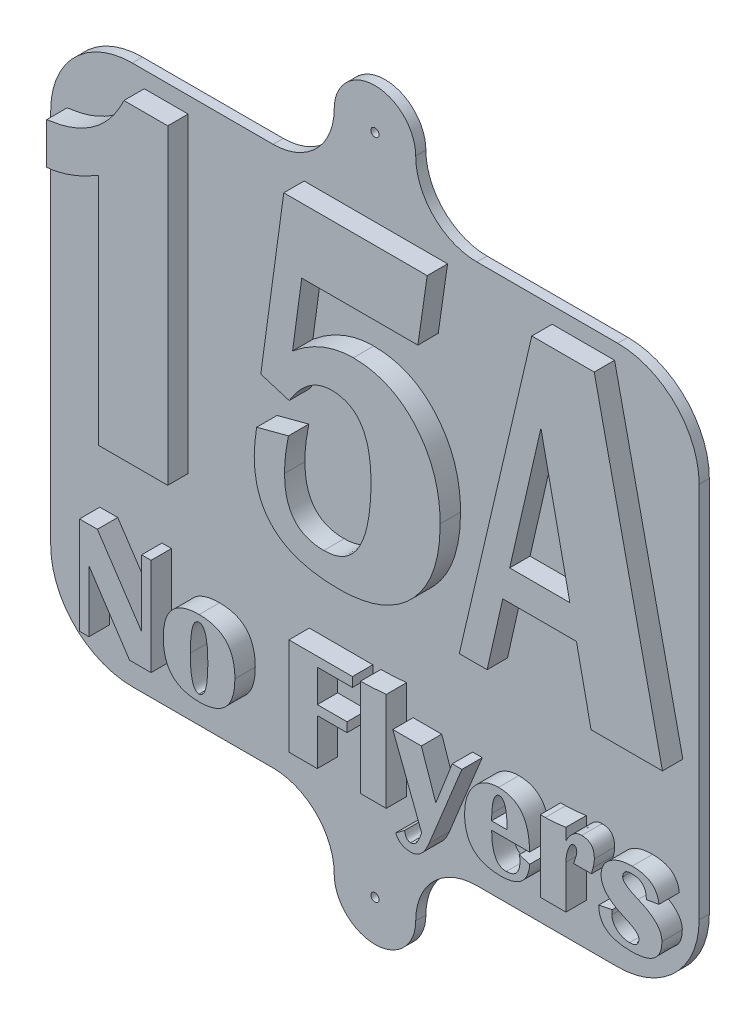
from build123d import *

# Parameters (mm, degrees)
BOSS_EXTRUDE3_DEPTH = 2.5
SKETCH3_W           = 79.552881877
SKETCH3_H           = 66.272296509
SKETCH3_R           = 0.5
BOSS_EXTRUDE4_DEPTH = 1.25
FILLET1_R           = 10


with BuildPart() as part:
    # Sketch2 → Boss-Extrude3 (new body)
    # profile 1 of 12: a face of its own
    with BuildSketch(Plane.XY):
        with BuildLine():
            add(Edge.make_bspline(
                [(-39.505642361, 34.550055371), (-38.445127374, 34.688560168), (-36.891314498, 35.018793509), (-35.009315958, 35.870899211), (-33.74203724, 36.630490301), (-32.614537052, 37.573280944), (-31.253370012, 39.06085279), (-30.463976145, 40.383787992), (-30.030445523, 41.322790119)],
                knots=[0, 0, 0, 0, 0.263348654, 0.386091944, 0.506109964, 0.625172173, 0.745756987, 1, 1, 1, 1], degree=3))
            Line((-30.030445523, 41.322790119), (-24.650390625, 41.322790119))
            Line((-24.650390625, 41.322790119), (-24.650390625, 3.123571362))
            Line((-24.650390625, 3.123571362), (-33.139105903, 3.123571362))
            Line((-33.139105903, 3.123571362), (-33.139105903, 31.814434237))
            add(Edge.make_bspline(
                [(-33.139105903, 31.814434237), (-34.190562264, 31.180201515), (-36.234098653, 30.145269288), (-38.455956486, 29.571261215), (-39.505642361, 29.485011392)],
                knots=[0, 0, 0, 0, 0.539331809, 1, 1, 1, 1], degree=3))
            Line((-39.505642361, 29.485011392), (-39.505642361, 34.550055371))
        make_face()
    # profile 2 of 12: a face of its own
    with BuildSketch(Plane.XY):
        with BuildLine():
            add(Edge.make_bspline(
                [(-4.580879211, 23.284270154), (-5.059567577, 23.28608701), (-5.782990797, 23.162477543), (-6.688456619, 22.774548571), (-7.349639699, 22.359116401), (-7.987212902, 21.832786439), (-8.850183119, 20.942489776), (-9.400196179, 20.145903569), (-9.753690084, 19.578746981)],
                knots=[0, 0, 0, 0, 0.215337028, 0.326396667, 0.442196288, 0.566125513, 0.6982596, 1, 1, 1, 1], degree=3))
            Line((-9.753690084, 19.578746981), (-13.235389709, 20.648126152))
            Line((-13.235389709, 20.648126152), (-10.416870965, 41.322790119))
            Line((-10.416870965, 41.322790119), (7.182291667, 41.322790119))
            Line((7.182291667, 41.322790119), (6.038304647, 33.364619546))
            Line((6.038304647, 33.364619546), (-8.211794535, 33.364619546))
            Line((-8.211794535, 33.364619546), (-9.339202033, 25.04998925))
            add(Edge.make_bspline(
                [(-9.339202033, 25.04998925), (-8.763173237, 25.526707746), (-7.878700057, 26.187072836), (-6.619881278, 26.889360816), (-5.68877436, 27.314716256), (-4.752312016, 27.649447295), (-3.492933144, 27.96063282), (-2.529162707, 28.056524037), (-1.886706882, 28.059172498)],
                knots=[0, 0, 0, 0, 0.273617619, 0.402082648, 0.526428614, 0.647547073, 0.765176175, 1, 1, 1, 1], degree=3))
            add(Edge.make_bspline(
                [(-1.886706882, 28.059172498), (-1.140841476, 28.048091191), (-0.030086294, 27.967005084), (1.37906108, 27.587424966), (2.375599175, 27.217388054), (3.314915233, 26.724394261), (4.199589184, 26.120890577), (5.03257365, 25.414171651), (5.797467794, 24.599408527), (6.500213345, 23.713190518), (7.109953259, 22.751053852), (7.620549298, 21.729899756), (8.052705652, 20.651107006), (8.368136201, 19.506929688), (8.687339903, 17.872330425), (8.769942937, 16.602413182), (8.773925781, 15.740587632)],
                knots=[0, 0, 0, 0, 0.122904352, 0.181634751, 0.23943005, 0.297339499, 0.355551071, 0.415172498, 0.476547268, 0.538982141, 0.60086089, 0.663434435, 0.726450003, 0.791595906, 0.858237271, 1, 1, 1, 1], degree=3))
            add(Edge.make_bspline(
                [(8.773925781, 15.740587632), (8.775493249, 14.784624301), (8.686794731, 13.376416231), (8.323182949, 11.576863806), (7.964081074, 10.328779394), (7.47409475, 9.168978643), (6.908996179, 8.070160772), (6.210531329, 7.065769782), (5.425080361, 6.135419684), (4.549004599, 5.298849359), (3.59048864, 4.570749654), (2.552728311, 3.968214616), (1.452712079, 3.452512816), (0.271579796, 3.067017359), (-1.438724347, 2.694397349), (-2.775838902, 2.596705671), (-3.685585022, 2.593026664)],
                knots=[0, 0, 0, 0, 0.140185445, 0.205864866, 0.268779519, 0.330146384, 0.390104813, 0.449524749, 0.508998478, 0.568289941, 0.626685414, 0.684955785, 0.74384205, 0.8044141, 0.866610454, 1, 1, 1, 1], degree=3))
            add(Edge.make_bspline(
                [(-3.685585022, 2.593026664), (-4.497357112, 2.587700427), (-5.675488444, 2.655371795), (-7.184831995, 2.887695521), (-8.196212841, 3.14267276), (-9.139359184, 3.436448016), (-9.990224348, 3.835437645), (-10.765554763, 4.288700123), (-11.462031127, 4.813802932), (-12.070534507, 5.4147509), (-12.595352473, 6.085605068), (-13.051673671, 6.821487136), (-13.409886945, 7.635556627), (-13.696403784, 8.515454112), (-13.961664415, 9.819802377), (-14.043575294, 10.843550354), (-14.039496528, 11.545968559)],
                knots=[0, 0, 0, 0, 0.155259741, 0.225407628, 0.291834243, 0.354701943, 0.414082297, 0.471209562, 0.526304094, 0.58051628, 0.634355904, 0.68894579, 0.745744241, 0.804098836, 0.865695261, 1, 1, 1, 1], degree=3))
            add(Edge.make_bspline(
                [(-14.039496528, 11.545968559), (-14.044192412, 12.030840125), (-13.967980077, 13.103855981), (-13.839429401, 14.171429561), (-13.741065131, 14.754106071)],
                knots=[0, 0, 0, 0, 0.450571848, 1, 1, 1, 1], degree=3))
            Line((-13.741065131, 14.754106071), (-9.844877455, 15.782036437))
            add(Edge.make_bspline(
                [(-9.844877455, 15.782036437), (-9.994612039, 15.046961321), (-10.226082233, 13.641057517), (-10.323306762, 12.219271686), (-10.325683594, 11.545968559)],
                knots=[0, 0, 0, 0, 0.527122793, 1, 1, 1, 1], degree=3))
            add(Edge.make_bspline(
                [(-10.325683594, 11.545968559), (-10.320110705, 10.702120337), (-10.229105589, 9.483504972), (-9.693211239, 8.043206132), (-9.155465437, 7.207702537), (-8.463278813, 6.549344714), (-7.264623028, 5.919277756), (-6.216531663, 5.774953975), (-5.501042684, 5.776294893)],
                knots=[0, 0, 0, 0, 0.295855371, 0.419781312, 0.532649116, 0.639755306, 0.749346034, 1, 1, 1, 1], degree=3))
            add(Edge.make_bspline(
                [(-5.501042684, 5.776294893), (-5.045254774, 5.781649336), (-4.371246406, 5.842162801), (-3.532560249, 6.117613131), (-2.962656256, 6.402271857), (-2.438993914, 6.769600946), (-1.959263911, 7.216094035), (-1.530841464, 7.743862513), (-1.134272633, 8.341668537), (-0.810012691, 9.033832726), (-0.507370742, 9.795326572), (-0.263149171, 10.642764361), (-0.065985036, 11.568556584), (0.088733138, 12.570659222), (0.251205259, 14.064313026), (0.278576995, 15.229128276), (0.285210503, 16.030729267)],
                knots=[0, 0, 0, 0, 0.103750029, 0.151958221, 0.199653436, 0.247861628, 0.296690369, 0.347937724, 0.401879003, 0.459116012, 0.521093761, 0.587793935, 0.659039074, 0.735878741, 0.817905989, 1, 1, 1, 1], degree=3))
            add(Edge.make_bspline(
                [(0.285210503, 16.030729267), (0.286619968, 16.597679808), (0.259018271, 17.422515281), (0.119691439, 18.479375082), (-0.010863514, 19.188118882), (-0.171771274, 19.845741927), (-0.393396701, 20.436775307), (-0.62555673, 20.986451231), (-0.923479598, 21.466375106), (-1.240444341, 21.901010341), (-1.606175863, 22.270956396), (-2.001928899, 22.591610221), (-2.451192391, 22.838971661), (-2.928992048, 23.038397625), (-3.637146716, 23.231850306), (-4.196212354, 23.293434873), (-4.580879211, 23.284270154)],
                knots=[0, 0, 0, 0, 0.171740255, 0.249366064, 0.322554505, 0.389926052, 0.453973794, 0.513524595, 0.570202533, 0.624586185, 0.67606019, 0.727281986, 0.778236591, 0.830753979, 0.883735839, 1, 1, 1, 1], degree=3))
        make_face()
    # profile 3 of 12: a face of its own
    with BuildSketch(Plane.XY):
        Polygon((20.014841715, 41.322790112), (27.674580892, 41.322790112), (36.047239516, 3.123571362), (27.284962124, 3.123571362), (25.494373745, 11.61228664), (16.45024448, 11.61228664), (14.535309686, 3.123571362), (11.119928148, 3.123571362), align=None)
        Polygon((21.133959452, 32.08799635), (17.304089864, 15.326099581), (24.681977166, 15.326099581), align=None, mode=Mode.SUBTRACT)
    # profile 4 of 12: a face of its own
    with BuildSketch(Plane.XY):
        Polygon((-27.853597005, -5.862141344), (-26.693030463, -5.862141344), (-26.693030463, -17.799397203), (-29.337982337, -17.799397203), (-34.319610596, -10.268667432), (-34.319610596, -17.799397203), (-35.480177138, -17.799397203), (-35.480177138, -5.862141344), (-33.28857157, -5.862141344), (-27.853597005, -14.032737042), align=None)
    # profile 5 of 12: a face of its own
    with BuildSketch(Plane.XY):
        with BuildLine():
            add(Edge.make_bspline(
                [(-25.200873481, -13.322926258), (-25.199808417, -12.959454358), (-25.170610217, -12.429366062), (-25.053861248, -11.753153678), (-24.936176467, -11.297121985), (-24.780327029, -10.877988715), (-24.59096547, -10.494601291), (-24.36763662, -10.14623384), (-24.106488807, -9.837252475), (-23.814163268, -9.561349058), (-23.484616436, -9.324272765), (-23.120168704, -9.125470124), (-22.722569715, -8.960824497), (-22.290683429, -8.835058779), (-21.649984916, -8.711225384), (-21.146730704, -8.680740914), (-20.802119043, -8.68066009)],
                knots=[0, 0, 0, 0, 0.148709658, 0.216464644, 0.280365154, 0.341042124, 0.399003812, 0.454936463, 0.509829317, 0.564045499, 0.618933808, 0.675359287, 0.733466031, 0.794589432, 0.859000225, 1, 1, 1, 1], degree=3))
            add(Edge.make_bspline(
                [(-20.802119043, -8.68066009), (-20.458326838, -8.680710705), (-19.956072807, -8.711637248), (-19.316855525, -8.83457038), (-18.886202032, -8.961471103), (-18.489739702, -9.124733528), (-18.126813559, -9.324922356), (-17.797890875, -9.562242945), (-17.502775238, -9.835485717), (-17.244691179, -10.147264352), (-17.02104323, -10.494509991), (-16.831133298, -10.87748126), (-16.678957565, -11.297681956), (-16.561476378, -11.753376473), (-16.438004565, -12.428650985), (-16.418797238, -12.96000657), (-16.413726807, -13.322926258)],
                knots=[0, 0, 0, 0, 0.140796589, 0.205275965, 0.266125469, 0.324294085, 0.380470138, 0.435416891, 0.489949248, 0.544673781, 0.600665988, 0.658689393, 0.719308422, 0.783276971, 0.851165802, 1, 1, 1, 1], degree=3))
            add(Edge.make_bspline(
                [(-16.413726807, -13.322926258), (-16.418797238, -13.685845946), (-16.438004565, -14.21720153), (-16.561476378, -14.892476042), (-16.678957565, -15.348170559), (-16.831133298, -15.768371255), (-17.02104323, -16.151342524), (-17.244691179, -16.498588164), (-17.502775238, -16.810366799), (-17.797890875, -17.083609571), (-18.126813559, -17.320930159), (-18.489739702, -17.521118987), (-18.886202032, -17.684381413), (-19.316855525, -17.811282136), (-19.956072807, -17.934215268), (-20.458326838, -17.965141811), (-20.802119043, -17.965192425)],
                knots=[0, 0, 0, 0, 0.148834198, 0.216723029, 0.280691578, 0.341310607, 0.399334012, 0.455326219, 0.510050752, 0.564583109, 0.619529862, 0.675705915, 0.733874531, 0.794724035, 0.859203411, 1, 1, 1, 1], degree=3))
            add(Edge.make_bspline(
                [(-20.802119043, -17.965192425), (-21.146730704, -17.965111601), (-21.649984916, -17.934627132), (-22.290683429, -17.810793737), (-22.722569715, -17.685028018), (-23.120168704, -17.520382392), (-23.484616436, -17.321579751), (-23.814163268, -17.084503458), (-24.106488807, -16.808600041), (-24.36763662, -16.499618675), (-24.59096547, -16.151251225), (-24.780327029, -15.7678638), (-24.936176467, -15.348730531), (-25.053861248, -14.892698838), (-25.170610217, -14.216486453), (-25.199808417, -13.686398158), (-25.200873481, -13.322926258)],
                knots=[0, 0, 0, 0, 0.140999775, 0.205410568, 0.266533969, 0.324640713, 0.381066192, 0.435954501, 0.490170683, 0.545063537, 0.600996188, 0.658957876, 0.719634846, 0.783535356, 0.851290342, 1, 1, 1, 1], degree=3))
        make_face()
        with BuildLine():
            add(Edge.make_bspline(
                [(-19.729631212, -13.322926258), (-19.730675228, -13.024962949), (-19.737838705, -12.592878169), (-19.76659198, -12.036877652), (-19.793499023, -11.664318995), (-19.83305778, -11.321461181), (-19.878546296, -11.00845158), (-19.933199784, -10.72501291), (-19.99315475, -10.470654785), (-20.066759975, -10.247030901), (-20.144410449, -10.050967549), (-20.236730775, -9.887548812), (-20.330623634, -9.748866754), (-20.438911892, -9.64370472), (-20.590800232, -9.540019439), (-20.72514179, -9.510022654), (-20.812481244, -9.509636192)],
                knots=[0, 0, 0, 0, 0.211632714, 0.306816891, 0.3953858, 0.476859122, 0.551882003, 0.619958308, 0.68183531, 0.737301971, 0.787071811, 0.83127019, 0.870409447, 0.905537857, 0.937855771, 1, 1, 1, 1], degree=3))
            add(Edge.make_bspline(
                [(-20.812481244, -9.509636192), (-20.899100261, -9.510273737), (-21.031990949, -9.540795701), (-21.18342877, -9.64288498), (-21.288848216, -9.749970757), (-21.383667612, -9.886674278), (-21.471844408, -10.051924451), (-21.55155504, -10.246337228), (-21.61971072, -10.471670964), (-21.685321549, -10.724440377), (-21.738049309, -11.008584614), (-21.78503807, -11.321243135), (-21.820280674, -11.664524716), (-21.847303173, -12.036939298), (-21.882824225, -12.59266235), (-21.879840725, -13.025124816), (-21.884969076, -13.322926258)],
                knots=[0, 0, 0, 0, 0.061623225, 0.093987349, 0.128729036, 0.167924257, 0.211890854, 0.261731858, 0.317090777, 0.379205207, 0.447378852, 0.522509005, 0.604031764, 0.692727315, 0.788081222, 1, 1, 1, 1], degree=3))
            add(Edge.make_bspline(
                [(-21.884969076, -13.322926258), (-21.879840725, -13.6207277), (-21.882824225, -14.053190166), (-21.847303173, -14.608913218), (-21.820280674, -14.981327799), (-21.78503807, -15.32460938), (-21.738049309, -15.637267901), (-21.685321549, -15.921412139), (-21.61971072, -16.174181552), (-21.55155504, -16.399515288), (-21.471844408, -16.593928064), (-21.383667612, -16.759178237), (-21.288848216, -16.895881758), (-21.18342877, -17.002967536), (-21.031990949, -17.105056815), (-20.899100261, -17.135578778), (-20.812481244, -17.136216324)],
                knots=[0, 0, 0, 0, 0.211918778, 0.307272685, 0.395968236, 0.477490995, 0.552621148, 0.620794793, 0.682909223, 0.738268142, 0.788109146, 0.832075743, 0.871270964, 0.906012651, 0.938376775, 1, 1, 1, 1], degree=3))
            add(Edge.make_bspline(
                [(-20.812481244, -17.136216324), (-20.72514179, -17.135829861), (-20.590800232, -17.105833076), (-20.438911892, -17.002147796), (-20.330623634, -16.896985762), (-20.236730775, -16.758303703), (-20.144410449, -16.594884966), (-20.066759975, -16.398821615), (-19.99315475, -16.17519773), (-19.933199784, -15.920839606), (-19.878546296, -15.637400936), (-19.83305778, -15.324391335), (-19.793499023, -14.981533521), (-19.76659198, -14.608974863), (-19.737838705, -14.052974347), (-19.730675228, -13.620889567), (-19.729631212, -13.322926258)],
                knots=[0, 0, 0, 0, 0.062144229, 0.094462143, 0.129590553, 0.16872981, 0.212928189, 0.262698029, 0.31816469, 0.380041692, 0.448117997, 0.523140878, 0.6046142, 0.693183109, 0.788367286, 1, 1, 1, 1], degree=3))
        make_face(mode=Mode.SUBTRACT)
    # profile 6 of 12: a face of its own
    with BuildSketch(Plane.XY):
        Polygon((-9.781917996, -5.862141344), (-1.989542643, -5.862141344), (-1.989542643, -7.022707885), (-6.30021837, -7.022707885), (-6.30021837, -11.001793172), (-2.652723524, -11.001793172), (-2.652723524, -12.162359714), (-6.30021837, -12.162359714), (-6.30021837, -17.799397203), (-9.781917996, -17.799397203), align=None)
    # profile 7 of 12: a face of its own
    with BuildSketch(Plane.XY):
        with BuildLine():
            add(Edge.make_bspline(
                [(-0.994771322, -5.862141346), (-0.514268133, -5.86334203), (0.537261582, -5.823421243), (1.586205255, -5.74139959), (2.155337863, -5.688574474)],
                knots=[0, 0, 0, 0, 0.456659504, 1, 1, 1, 1], degree=3))
            Line((2.155337863, -5.688574474), (2.155337863, -17.799397203))
            Line((2.155337863, -17.799397203), (-0.994771322, -17.799397203))
            Line((-0.994771322, -17.799397203), (-0.994771322, -5.862141346))
        make_face()
    # profile 8 of 12: a face of its own
    with BuildSketch(Plane.XY):
        Polygon((7.855578814, -17.799397203), (11.43987018, -9.012250516), (10.2585793, -9.012250526), (8.237950026, -14.180398397), (6.463423086, -9.012250506), (2.958408508, -9.012250506), (6.339029341, -17.799397203), align=None)
    # profile 9 of 12: a face of its own
    with BuildSketch(Plane.XY):
        with BuildLine():
            Line((7.401202255, -18.913333841), (7.855578814, -17.799397203))
            Line((7.855578814, -17.799397203), (6.339029341, -17.799397203))
            Line((6.339029341, -17.799397203), (6.507462396, -18.237200209))
            Line((6.507462396, -18.237200209), (6.271722317, -18.840798432))
            add(Edge.make_bspline(
                [(5.15260458, -19.954735068), (5.265802059, -19.954827595), (5.436099503, -19.916788761), (5.642671433, -19.801609873), (5.786170647, -19.674526737), (5.923083898, -19.51607111), (6.100314602, -19.242697678), (6.207626114, -19.008724332), (6.271722317, -18.840798432)],
                knots=[0, 0, 0, 0, 0.20135575, 0.305644868, 0.419428644, 0.541915361, 0.678833604, 1, 1, 1, 1], degree=3))
            add(Edge.make_bspline(
                [(4.409116639, -19.022136954), (4.43122098, -19.159352125), (4.469553453, -19.355261631), (4.568248762, -19.586153396), (4.653001256, -19.721195411), (4.756553301, -19.82572132), (4.917252549, -19.925910159), (5.058377186, -19.955038686), (5.15260458, -19.954735068)],
                knots=[0, 0, 0, 0, 0.318403671, 0.451751149, 0.571534756, 0.680293407, 0.784803943, 1, 1, 1, 1], degree=3))
            Line((4.409116639, -19.022136954), (3.308132754, -19.822617002))
            add(Edge.make_bspline(
                [(5.162966781, -20.94950639), (4.952584345, -20.94823218), (4.644503742, -20.920079381), (4.262877942, -20.800994057), (4.015508119, -20.672788572), (3.791945533, -20.515852717), (3.532597663, -20.244395672), (3.384717474, -19.999703564), (3.308132754, -19.822617002)],
                knots=[0, 0, 0, 0, 0.273060386, 0.397685986, 0.515848346, 0.632977305, 0.750149058, 1, 1, 1, 1], degree=3))
            add(Edge.make_bspline(
                [(7.401202255, -18.913333841), (7.271430513, -19.219251362), (7.068507035, -19.655198063), (6.711621668, -20.149181966), (6.440803878, -20.441013446), (6.148135151, -20.666381275), (5.736039843, -20.887437348), (5.390714718, -20.950582518), (5.162966781, -20.94950639)],
                knots=[0, 0, 0, 0, 0.310559017, 0.444830134, 0.566673871, 0.68033092, 0.787619396, 1, 1, 1, 1], degree=3))
        make_face()
    # profile 10 of 12: a face of its own
    with BuildSketch(Plane.XY):
        with BuildLine():
            add(Edge.make_bspline(
                [(18.56906467, -15.167398083), (18.564853802, -14.857239024), (18.470623758, -14.561209309)],
                knots=[0, 0, 0, 1, 1, 1], degree=2))
            Line((18.470623758, -14.561209309), (19.755536715, -14.936839105))
            add(Edge.make_bspline(
                [(19.755536715, -14.936839105), (19.740772735, -15.175284096), (19.696404618, -15.52338937), (19.574966039, -15.961960607), (19.464308676, -16.259500724), (19.326574833, -16.533459547), (19.162331676, -16.783115745), (18.974820137, -17.010855073), (18.761760322, -17.213662183), (18.522358537, -17.390811432), (18.260443601, -17.547687725), (17.970831946, -17.675862102), (17.657949274, -17.782732944), (17.319710157, -17.864720589), (16.821248846, -17.946768217), (16.431243939, -17.961698085), (16.165033976, -17.965192425)],
                knots=[0, 0, 0, 0, 0.135123648, 0.19740768, 0.256874256, 0.314280181, 0.370323378, 0.425440815, 0.480676976, 0.536121906, 0.593459322, 0.652877808, 0.714770498, 0.780113684, 0.849359563, 1, 1, 1, 1], degree=3))
            add(Edge.make_bspline(
                [(16.165033976, -17.965192425), (15.821386549, -17.964112716), (15.319537562, -17.934814873), (14.679729857, -17.817918545), (14.247540983, -17.700718952), (13.851206979, -17.543908593), (13.487495582, -17.35508031), (13.159409471, -17.127860407), (12.864173577, -16.868097449), (12.605965295, -16.572048594), (12.381934859, -16.243172317), (12.191991641, -15.879745034), (12.036046546, -15.481223945), (11.919059916, -15.047352154), (11.801324715, -14.40508605), (11.772806716, -13.901404484), (11.771460639, -13.556075786)],
                knots=[0, 0, 0, 0, 0.14444976, 0.210484388, 0.272977827, 0.332263421, 0.389223355, 0.44477362, 0.499517175, 0.554020976, 0.60936591, 0.666325844, 0.725949042, 0.788792175, 0.854826803, 1, 1, 1, 1], degree=3))
            add(Edge.make_bspline(
                [(11.771460639, -13.556075786), (11.77073992, -13.214665126), (11.805250045, -12.711395324), (11.925728983, -12.062157109), (12.056968679, -11.610472532), (12.219117029, -11.181523855), (12.423440121, -10.779668846), (12.659183417, -10.397991839), (12.932978775, -10.045709832), (13.233598322, -9.725975031), (13.557411444, -9.445119868), (13.902509118, -9.208756628), (14.268635377, -9.015518534), (14.654067817, -8.863706646), (15.205586923, -8.720907669), (15.637174844, -8.678677718), (15.929293897, -8.68066009)],
                knots=[0, 0, 0, 0, 0.142686151, 0.210298815, 0.275652494, 0.339072343, 0.401710682, 0.463814158, 0.526344223, 0.58788702, 0.647010764, 0.705184645, 0.762348458, 0.819730699, 0.877957197, 1, 1, 1, 1], degree=3))
            add(Edge.make_bspline(
                [(15.929293897, -8.68066009), (16.22901503, -8.676999003), (16.666014518, -8.716183681), (17.221484447, -8.843935756), (17.594170382, -8.983766106), (17.940562896, -9.156742948), (18.254587709, -9.37368698), (18.541192064, -9.627564381), (18.794602794, -9.922212688), (19.020193385, -10.254465671), (19.2099223, -10.627407135), (19.374156101, -11.037357176), (19.507746826, -11.485730467), (19.610349608, -11.973679092), (19.713294388, -12.698376768), (19.735567379, -13.265498833), (19.737402863, -13.654516698)],
                knots=[0, 0, 0, 0, 0.125618181, 0.183354183, 0.238608642, 0.292241639, 0.345403866, 0.398268957, 0.452461965, 0.508032677, 0.566369199, 0.627660775, 0.693110775, 0.762395531, 0.836691311, 1, 1, 1, 1], degree=3))
            Line((19.737402863, -13.654516698), (15.087365044, -13.654516698))
            add(Edge.make_bspline(
                [(15.087365044, -13.654516698), (15.087923687, -13.926737019), (15.100713721, -14.322114305), (15.145274986, -14.829990396), (15.194179837, -15.170823434), (15.258474278, -15.483962881), (15.336302141, -15.770355584), (15.425062079, -16.030561777), (15.532328267, -16.262386634), (15.650419028, -16.46827227), (15.7836745, -16.647277642), (15.931398289, -16.798669671), (16.09466632, -16.922603179), (16.271681025, -17.01949444), (16.533139033, -17.111262499), (16.742820477, -17.137839316), (16.885206964, -17.136216324)],
                knots=[0, 0, 0, 0, 0.186872958, 0.271402526, 0.349871821, 0.423115567, 0.490705123, 0.553511117, 0.61159943, 0.665791173, 0.71617914, 0.764385815, 0.810506235, 0.856397503, 0.902334693, 1, 1, 1, 1], degree=3))
            add(Edge.make_bspline(
                [(16.885206964, -17.136216324), (17.017060806, -17.136770142), (17.209881978, -17.122201072), (17.455230636, -17.07076468), (17.619976917, -17.014234456), (17.774398607, -16.949543735), (17.911679044, -16.861632551), (18.038962133, -16.762375385), (18.151752393, -16.64619207), (18.252512448, -16.514373684), (18.336279365, -16.366242409), (18.411201639, -16.204174731), (18.465234696, -16.024706956), (18.513078172, -15.832233361), (18.559551356, -15.545770907), (18.565589263, -15.321156688), (18.56906467, -15.167398083)],
                knots=[0, 0, 0, 0, 0.133242546, 0.194893114, 0.252873385, 0.30916594, 0.363676653, 0.417128256, 0.472077708, 0.526909116, 0.584414131, 0.643810189, 0.707041719, 0.773534568, 0.844298275, 1, 1, 1, 1], degree=3))
        make_face()
        with BuildLine():
            add(Edge.make_bspline(
                [(16.056230863, -9.509636192), (15.98922311, -9.513238583), (15.885303486, -9.525833976), (15.764131381, -9.59066961), (15.678312915, -9.655072832), (15.598586811, -9.737990019), (15.526181853, -9.840986596), (15.459638353, -9.960395069), (15.396640359, -10.096976492), (15.340102939, -10.251970237), (15.291923725, -10.426444642), (15.247977474, -10.618360646), (15.209465809, -10.828438801), (15.175991386, -11.057424734), (15.136487222, -11.398093417), (15.122349075, -11.663981503), (15.113270548, -11.846312577)],
                knots=[0, 0, 0, 0, 0.074799915, 0.112302935, 0.150418339, 0.192872552, 0.238620962, 0.288970819, 0.343543773, 0.404439021, 0.470799789, 0.543150066, 0.621646054, 0.706409991, 0.798485519, 1, 1, 1, 1], degree=3))
            Line((15.113270548, -11.846312577), (15.077002843, -12.659745377))
            Line((15.077002843, -12.659745377), (16.983647876, -12.659745377))
            add(Edge.make_bspline(
                [(16.983647876, -12.659745377), (16.986613156, -12.413529336), (16.976551842, -12.056650226), (16.951052571, -11.597468053), (16.93040487, -11.289491437), (16.894341806, -11.006590903), (16.859049673, -10.747259094), (16.8066427, -10.514189566), (16.758561105, -10.303259051), (16.695399189, -10.118270591), (16.626412917, -9.957751278), (16.551227584, -9.82066733), (16.469174037, -9.707385265), (16.376742284, -9.619901206), (16.245637795, -9.534493835), (16.130716279, -9.510973528), (16.056230863, -9.509636192)],
                knots=[0, 0, 0, 0, 0.210509254, 0.30516383, 0.393282651, 0.474337073, 0.549001691, 0.616921121, 0.678526553, 0.733866075, 0.78379863, 0.827762033, 0.867339774, 0.902859112, 0.936045415, 1, 1, 1, 1], degree=3))
        make_face(mode=Mode.SUBTRACT)
    # profile 11 of 12: a face of its own
    with BuildSketch(Plane.XY):
        with BuildLine():
            add(Edge.make_bspline(
                [(27.522006565, -11.442186728), (27.496388681, -11.542205828), (27.43932912, -11.783583707), (27.370770115, -12.021989457), (27.335486942, -12.162359716)],
                knots=[0, 0, 0, 0, 0.416359552, 1, 1, 1, 1], degree=3))
            Line((27.335486942, -12.162359716), (25.151653025, -12.162359716))
            add(Edge.make_bspline(
                [(25.151653025, -12.162359716), (25.189996241, -12.01017883), (25.261460339, -11.751359664), (25.347575622, -11.497059708), (25.387393104, -11.392966272)],
                knots=[0, 0, 0, 0, 0.584792295, 1, 1, 1, 1], degree=3))
            add(Edge.make_bspline(
                [(25.387393104, -11.392966272), (25.435788298, -11.282130893), (25.499790172, -11.06581874), (25.535359075, -10.842642918), (25.532463921, -10.737557042)],
                knots=[0, 0, 0, 0, 0.53565744, 1, 1, 1, 1], degree=3))
            add(Edge.make_bspline(
                [(25.532463921, -10.737557042), (25.528305713, -10.65595899), (25.525744622, -10.535969959), (25.476421736, -10.396186399), (25.434384213, -10.311757459), (25.370952157, -10.250383158), (25.268183985, -10.188287265), (25.17590543, -10.169494608), (25.11279477, -10.172817073)],
                knots=[0, 0, 0, 0, 0.309173326, 0.439002662, 0.553293299, 0.658440686, 0.764330823, 1, 1, 1, 1], degree=3))
            add(Edge.make_bspline(
                [(25.11279477, -10.172817073), (25.055376334, -10.168985325), (24.972212366, -10.203209421), (24.870241862, -10.277476736), (24.794787218, -10.362558499), (24.715006748, -10.466648793), (24.64288343, -10.597528769), (24.56574774, -10.748397898), (24.47199645, -10.983113355), (24.366248847, -11.295629891), (24.238894672, -11.819166435), (24.207348356, -12.225125393), (24.206102159, -12.496540707)],
                knots=[0, 0, 0, 0, 0.063446169, 0.10011845, 0.143357127, 0.192644977, 0.249623096, 0.313545467, 0.386037155, 0.537846933, 0.689909337, 1, 1, 1, 1], degree=3))
            Line((24.206102159, -12.496540707), (24.206102159, -17.7993972))
            Line((24.206102159, -17.7993972), (21.055992974, -17.7993972))
            Line((21.055992974, -17.7993972), (21.055992974, -9.012250531))
            Line((21.055992974, -9.012250531), (21.669953399, -9.012250531))
            add(Edge.make_bspline(
                [(21.669953399, -9.012250531), (22.062507813, -9.008891143), (22.912052493, -8.96829631), (23.75462677, -8.852190377), (24.206102159, -8.781691553)],
                knots=[0, 0, 0, 0, 0.462037773, 1, 1, 1, 1], degree=3))
            Line((24.206102159, -8.781691553), (24.206102159, -10.216856428))
            add(Edge.make_bspline(
                [(24.206102159, -10.216856428), (24.323890049, -9.980787647), (24.524451726, -9.657560498), (24.834990923, -9.282751579), (25.07117728, -9.063153734), (25.31969748, -8.890267764), (25.667081086, -8.73130436), (25.946850846, -8.677460664), (26.133471595, -8.68066009)],
                knots=[0, 0, 0, 0, 0.304429359, 0.43746685, 0.56095755, 0.675739074, 0.785498968, 1, 1, 1, 1], degree=3))
            add(Edge.make_bspline(
                [(26.133471595, -8.68066009), (26.363650145, -8.677719741), (26.699297598, -8.721362997), (27.08478853, -8.911672487), (27.311220527, -9.104864119), (27.483821583, -9.355368521), (27.656473209, -9.784795147), (27.687411463, -10.150690235), (27.687801785, -10.403376051)],
                knots=[0, 0, 0, 0, 0.260754884, 0.373235411, 0.481087878, 0.593056078, 0.713263861, 1, 1, 1, 1], degree=3))
            add(Edge.make_bspline(
                [(27.687801785, -10.403376051), (27.687663336, -10.566582537), (27.654203034, -10.917659807), (27.572912475, -11.260642967), (27.522006565, -11.442186728)],
                knots=[0, 0, 0, 0, 0.463654351, 1, 1, 1, 1], degree=3))
        make_face()
    # profile 12 of 12: a face of its own
    with BuildSketch(Plane.XY):
        with BuildLine():
            add(Edge.make_bspline(
                [(32.337839603, -8.84645531), (32.573109446, -8.847341028), (32.916899106, -8.864105998), (33.35782937, -8.927261342), (33.658711093, -8.991518507), (33.937631959, -9.07675619), (34.19692975, -9.17984228), (34.43359598, -9.305903822), (34.652104985, -9.4468905), (34.847559296, -9.609526639), (35.023648215, -9.788340388), (35.173354852, -9.990778118), (35.306300835, -10.208712117), (35.419201364, -10.446057089), (35.536335162, -10.798217714), (35.597284824, -11.076021952), (35.617476304, -11.268619857)],
                knots=[0, 0, 0, 0, 0.155209907, 0.226573938, 0.293601657, 0.35792013, 0.418733774, 0.477330719, 0.534515618, 0.589937543, 0.644714817, 0.699619264, 0.755588666, 0.812912373, 0.872530096, 1, 1, 1, 1], degree=3))
            Line((35.617476304, -11.268619857), (34.070917765, -11.54062764))
            add(Edge.make_bspline(
                [(34.070917765, -11.54062764), (34.070177277, -11.394312068), (34.057507927, -11.18133832), (34.012776032, -10.9091342), (33.963321172, -10.725977025), (33.898618312, -10.55780328), (33.82116333, -10.403619934), (33.728965817, -10.265360372), (33.6259067, -10.137984901), (33.502189588, -10.031406863), (33.369765218, -9.932761554), (33.220964387, -9.853133742), (33.058227393, -9.788243911), (32.882278171, -9.736483103), (32.619971907, -9.6867463), (32.414044281, -9.677288351), (32.273075846, -9.675431412)],
                knots=[0, 0, 0, 0, 0.147680676, 0.214882495, 0.278100275, 0.338798496, 0.396487325, 0.451844388, 0.506302176, 0.561239105, 0.616155289, 0.672707051, 0.730972389, 0.792749829, 0.857534348, 1, 1, 1, 1], degree=3))
            add(Edge.make_bspline(
                [(32.273075846, -9.675431412), (32.110624754, -9.671356853), (31.879871817, -9.697587113), (31.602963632, -9.792088815), (31.443037773, -9.894240261), (31.318698478, -10.025663699), (31.196811781, -10.250637041), (31.170327705, -10.448177504), (31.169501411, -10.582124023)],
                knots=[0, 0, 0, 0, 0.298125648, 0.423180332, 0.534592386, 0.643533902, 0.752243824, 1, 1, 1, 1], degree=3))
            add(Edge.make_bspline(
                [(31.169501411, -10.582124023), (31.166249901, -10.707608336), (31.253100825, -10.892400852), (31.441781242, -11.112851452), (31.653473741, -11.290613837), (31.92265607, -11.470985244), (32.393068317, -11.731738661), (32.78559766, -11.908293011), (33.068374793, -12.022469999)],
                knots=[0, 0, 0, 0, 0.146897998, 0.239582503, 0.349936625, 0.48002213, 0.631095078, 1, 1, 1, 1], degree=3))
            add(Edge.make_bspline(
                [(33.068374793, -12.022469999), (33.300760295, -12.113421576), (33.63144468, -12.26869663), (34.053703552, -12.485156949), (34.337259402, -12.652684864), (34.599399153, -12.822387281), (34.838319193, -12.999706589), (35.056680191, -13.179116914), (35.249152071, -13.367708474), (35.421138129, -13.558710493), (35.569750028, -13.756146841), (35.694650351, -13.959560303), (35.798368653, -14.166427846), (35.881660378, -14.378181475), (35.950391666, -14.670866251), (35.982688944, -14.894366402), (35.977562798, -15.045642218)],
                knots=[0, 0, 0, 0, 0.167901542, 0.245928079, 0.319429103, 0.389587831, 0.456112453, 0.519695117, 0.579732862, 0.637391809, 0.692633807, 0.745890596, 0.797901064, 0.848333789, 0.898682636, 1, 1, 1, 1], degree=3))
            add(Edge.make_bspline(
                [(35.977562798, -15.045642218), (35.976800215, -15.274644328), (35.950525916, -15.609776961), (35.852821931, -16.035277834), (35.748627397, -16.322103316), (35.615058528, -16.586068463), (35.455327237, -16.82957568), (35.259696101, -17.04537639), (35.038716182, -17.242235355), (34.78445463, -17.412078255), (34.504447951, -17.563994625), (34.192192823, -17.686803804), (33.853154329, -17.791413653), (33.483196591, -17.866739853), (32.934741386, -17.945056046), (32.505950027, -17.968028268), (32.210902638, -17.965192425)],
                knots=[0, 0, 0, 0, 0.126278041, 0.184476322, 0.240197781, 0.294062092, 0.347272374, 0.400209366, 0.454174562, 0.51002805, 0.568387715, 0.629473908, 0.694680303, 0.763773075, 0.837359472, 1, 1, 1, 1], degree=3))
            add(Edge.make_bspline(
                [(32.210902638, -17.965192425), (31.899325862, -17.968760444), (31.446902311, -17.943824419), (30.866526262, -17.868245962), (30.47664466, -17.786625466), (30.115367656, -17.689139415), (29.787890436, -17.560100832), (29.488835133, -17.414077355), (29.224141584, -17.238937194), (28.987925017, -17.044136699), (28.783962474, -16.82470369), (28.612433977, -16.582090725), (28.470192714, -16.317151099), (28.362532329, -16.028401309), (28.255597715, -15.60226953), (28.229428756, -15.265107542), (28.229226801, -15.035280017)],
                knots=[0, 0, 0, 0, 0.165836588, 0.241021632, 0.31146198, 0.377854312, 0.440027149, 0.498642057, 0.554764856, 0.608641981, 0.661358401, 0.713803319, 0.766473582, 0.821052718, 0.877491175, 1, 1, 1, 1], degree=3))
            Line((28.229226801, -15.035280017), (29.874226252, -14.706280127))
            add(Edge.make_bspline(
                [(29.874226252, -14.706280127), (29.844070779, -14.97486643), (29.843139648, -15.245114593)],
                knots=[0, 0, 0, 1, 1, 1], degree=2))
            add(Edge.make_bspline(
                [(29.843139648, -15.245114593), (29.842017477, -15.369022078), (29.865349102, -15.553012597), (29.929925284, -15.790259752), (30.001451141, -15.960254931), (30.091892894, -16.124139523), (30.205300916, -16.279629626), (30.335327177, -16.431232004), (30.484080485, -16.573715344), (30.645811569, -16.70642858), (30.820365215, -16.818530355), (30.99853117, -16.919837522), (31.186798279, -16.995552199), (31.379970992, -17.06025064), (31.652151717, -17.116846323), (31.861771456, -17.14007467), (32.003658613, -17.136216324)],
                knots=[0, 0, 0, 0, 0.116687927, 0.174247997, 0.231628814, 0.290383121, 0.350562421, 0.412991325, 0.478718567, 0.544798778, 0.610145724, 0.674364145, 0.737953341, 0.801375087, 0.866457057, 1, 1, 1, 1], degree=3))
            add(Edge.make_bspline(
                [(32.003658613, -17.136216324), (32.172201965, -17.132913665), (32.417996907, -17.118750736), (32.705405735, -17.007810481), (32.873921377, -16.90166719), (33.003226132, -16.760905056), (33.132443962, -16.522560518), (33.158766286, -16.310580895), (33.159044054, -16.167350505)],
                knots=[0, 0, 0, 0, 0.295703622, 0.419895235, 0.532858681, 0.639210732, 0.748835917, 1, 1, 1, 1], degree=3))
            add(Edge.make_bspline(
                [(33.159044054, -16.167350505), (33.160989014, -16.044413581), (33.077856286, -15.861526815), (32.89212924, -15.645078787), (32.685421223, -15.469809072), (32.423903609, -15.288610132), (31.966085959, -15.024823137), (31.583240857, -14.844770724), (31.306800577, -14.72959508)],
                knots=[0, 0, 0, 0, 0.147049667, 0.239899573, 0.349930743, 0.479724762, 0.631272194, 1, 1, 1, 1], degree=3))
            add(Edge.make_bspline(
                [(31.306800577, -14.72959508), (31.086951497, -14.631929693), (30.764939423, -14.485895928), (30.362352448, -14.263357704), (30.089242522, -14.094596893), (29.838635158, -13.921510226), (29.607971387, -13.745072007), (29.401111688, -13.560649778), (29.213508665, -13.372444627), (29.049891228, -13.176749505), (28.906018887, -12.977758702), (28.786808165, -12.771495069), (28.686903476, -12.561583531), (28.612021073, -12.344946436), (28.538799729, -12.049091893), (28.515152135, -11.820616555), (28.516777886, -11.667564605)],
                knots=[0, 0, 0, 0, 0.164236802, 0.240987535, 0.313755548, 0.383223061, 0.448755349, 0.511783939, 0.572202298, 0.629919525, 0.685678417, 0.739546411, 0.792267729, 0.844075552, 0.89566846, 1, 1, 1, 1], degree=3))
            add(Edge.make_bspline(
                [(28.516777886, -11.667564605), (28.513049967, -11.468601007), (28.549625198, -11.1745747), (28.661183459, -10.800347197), (28.778282615, -10.537121835), (28.930838836, -10.288952464), (29.115580942, -10.054623062), (29.335952689, -9.836218736), (29.586498444, -9.633292614), (29.861720529, -9.447857256), (30.158876219, -9.285577512), (30.476971885, -9.15299874), (30.810666528, -9.036412738), (31.166110283, -8.952958344), (31.674524952, -8.867230905), (32.069752882, -8.848346763), (32.337839603, -8.84645531)],
                knots=[0, 0, 0, 0, 0.112419474, 0.166553469, 0.220612347, 0.275030396, 0.331075677, 0.389154676, 0.450316723, 0.513370358, 0.576815136, 0.641653653, 0.708290222, 0.776710782, 0.848084274, 1, 1, 1, 1], degree=3))
        make_face()
    extrude(amount=BOSS_EXTRUDE3_DEPTH)

    # Sketch3 → Boss-Extrude4 (add)
    # profile 1 of 3: a face of its own
    with BuildSketch(Plane.XY):
        with BuildLine():
            ThreePointArc((-6.729201423, 50.822790119), (-8.925900564, 45.51948926), (-14.229201423, 43.322790119))
            Line((-14.229201423, 43.322790119), (-6.729201423, 43.322790119))
            Line((-6.729201423, 43.322790119), (-1.729201423, 43.322790119))
            Line((-1.729201423, 43.322790119), (3.270798577, 43.322790119))
            Line((3.270798577, 43.322790119), (10.770798577, 43.322790119))
            ThreePointArc((10.770798577, 43.322790119), (5.467497718, 45.51948926), (3.270798577, 50.822790119))
            ThreePointArc((3.270798577, 50.822790119), (-1.729201423, 55.822790119), (-6.729201423, 50.822790119))
        make_face()
        with BuildLine():
            ThreePointArc((-1.229201423, 50.822790119), (-1.729201423, 50.322790119), (-2.229201423, 50.822790119))
            ThreePointArc((-2.229201423, 50.822790119), (-1.729201423, 51.322790119), (-1.229201423, 50.822790119))
        make_face(mode=Mode.SUBTRACT)
    # profile 2 of 3: a face of its own
    with BuildSketch(Plane.XY):
        with Locations((-1.729201422, 10.186641865)):
            Rectangle(SKETCH3_W, SKETCH3_H)
    # profile 3 of 3: a face of its own
    with BuildSketch(Plane.XY):
        with BuildLine():
            Line((10.770798577, -22.94950639), (-14.229201423, -22.94950639))
            ThreePointArc((-14.229201423, -22.94950639), (-8.925900564, -25.146205531), (-6.729201423, -30.44950639))
            ThreePointArc((-6.729201423, -30.44950639), (-1.729201423, -35.44950639), (3.270798577, -30.44950639))
            ThreePointArc((3.270798577, -30.44950639), (5.467497718, -25.146205531), (10.770798577, -22.94950639))
        make_face()
        with Locations((-1.729201423, -30.44950639)):
            Circle(SKETCH3_R, mode=Mode.SUBTRACT)
    extrude(amount=-BOSS_EXTRUDE4_DEPTH)

    # Fillet1
    fillet1_edges = [part.edges().sort_by_distance(p)[0] for p in [
        (38.047239516, 43.322790119, -0.625),
        (38.047239516, -22.94950639, -0.625),
        (-41.505642361, -22.94950639, -0.625),
        (-41.505642361, 43.322790119, -0.625),
    ]]
    fillet(fillet1_edges, radius=FILLET1_R)


solid = part.part
